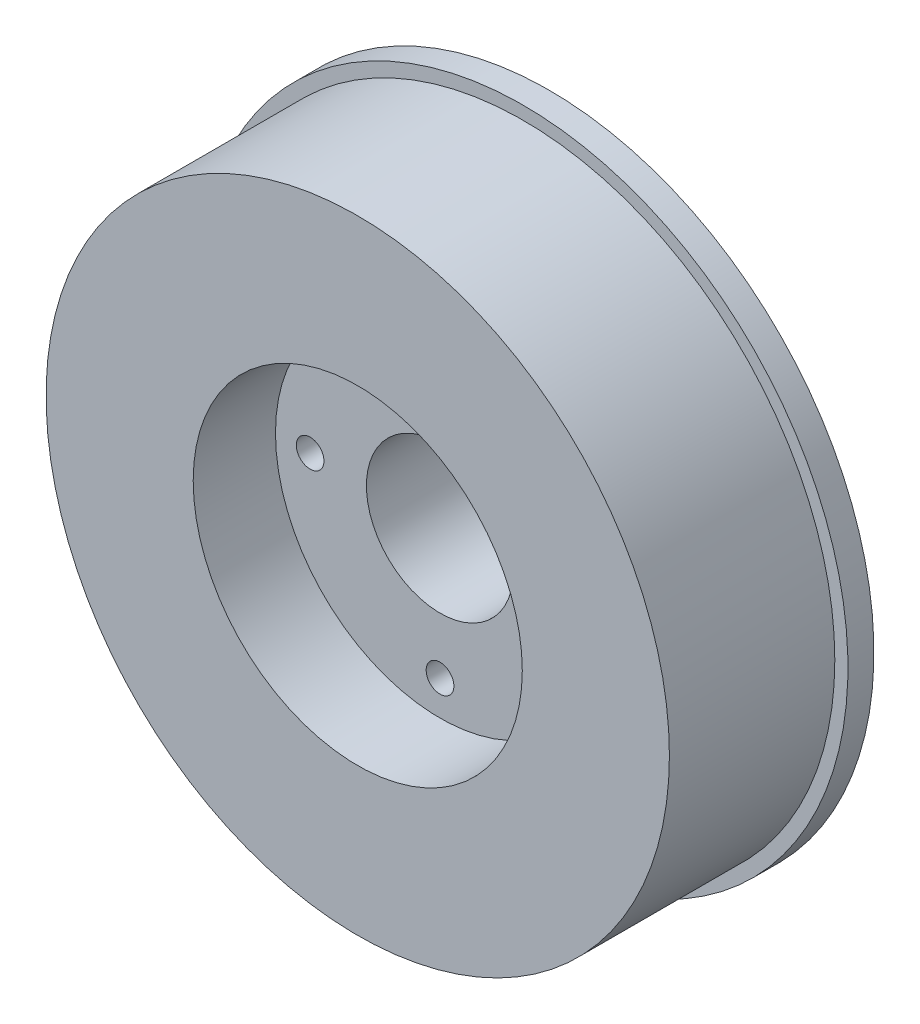
from build123d import *

# Parameters (mm, degrees)
EXTRUDE_START            = 9.5
SKETCH_1_R               = 35.986394748
EXTRUDE_1_DEPTH          = 19.1
SKETCH_1_3_R             = 19
CUT_EXTRUDE_1_DEPTH      = 52.789972136
EXTRUDE_START_2          = -12.6
SKETCH_1_4_R             = 37.5
EXTRUDE_2_DEPTH          = 3
CUT_EXTRUDE_2_DEPTH      = 55.509265267
CUT_EXTRUDE_2_DEPTH_BACK = 55.509265267
SKETCH_1_5_R             = 8.5
HOLE_WIZARD_M3_1_D       = 3.2


with BuildPart() as part:
    # ｽｹｯﾁ1 → ﾎﾞｽ - 押し出し1 (new body)
    with BuildSketch(Plane.XY.offset(EXTRUDE_START)):
        Circle(SKETCH_1_R)
    extrude(amount=-EXTRUDE_1_DEPTH)

    # ｽｹｯﾁ1<3> → ｶｯﾄ - 押し出し1 (cut, through all)
    with BuildSketch(Plane.XY):
        Circle(SKETCH_1_3_R)
    extrude(amount=CUT_EXTRUDE_1_DEPTH, mode=Mode.SUBTRACT)

    # ｽｹｯﾁ1<4> → ﾎﾞｽ - 押し出し2 (add)
    with BuildSketch(Plane.XY.offset(EXTRUDE_START_2)):
        Circle(SKETCH_1_4_R)
    extrude(amount=EXTRUDE_2_DEPTH)

    # ｽｹｯﾁ1<5> → ｶｯﾄ - 押し出し2 (cut, two sides: drawn at the far end of the back side and taken through both)
    with BuildSketch(Plane.XY.offset(-CUT_EXTRUDE_2_DEPTH_BACK)):
        Circle(SKETCH_1_5_R)
    extrude(amount=CUT_EXTRUDE_2_DEPTH + CUT_EXTRUDE_2_DEPTH_BACK, mode=Mode.SUBTRACT)

    # M3 すきま穴1 (through all)
    with Locations(Plane(origin=(0, 15, 0), x_dir=(1, 0, 0), z_dir=(0, 0, 1))):
        with Locations((0, 0), (-15, -15), (0, -30), (15, -15)):
            Hole(HOLE_WIZARD_M3_1_D / 2)


solid = part.part
